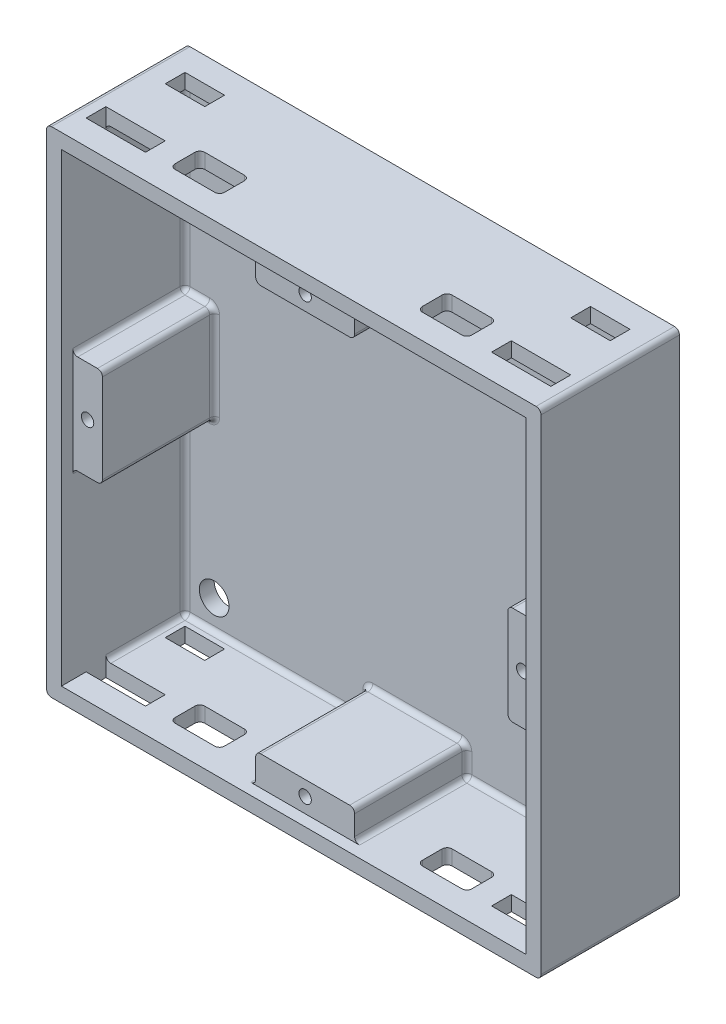
from build123d import *

# Parameters (mm, degrees)
SKETCH1_W                 = 100
SKETCH1_H                 = 100
BOSS_EXTRUDE1_DEPTH       = 3
SKETCH2_W                 = 100
SKETCH2_H                 = 100
SKETCH2_W_2               = 94
SKETCH2_H_2               = 94
BOSS_EXTRUDE2_DEPTH       = 25
SKETCH5_R                 = 3
CUT_EXTRUDE1_DEPTH        = 146.107718609
SKETCH6_W                 = 12
SKETCH6_H                 = 4
SKETCH6_W_2               = 8
CUT_EXTRUDE3_DEPTH        = 145.166570328
SKETCH7_W                 = 6
SKETCH7_H                 = 20
SKETCH7_W_2               = 20
SKETCH7_H_2               = 6
BOSS_EXTRUDE4_DEPTH       = 22.7
M3X0_5_TAPPED_HOLE1_D     = 2.5
M3X0_5_TAPPED_HOLE1_DEPTH = 27
M3X0_5_TAPPED_HOLE1_TIP   = 0.751075774
FILLET1_R                 = 1
FILLET2_R                 = 1
FILLET3_R                 = 1
FILLET4_R                 = 1
FILLET5_R                 = 1
FILLET6_R                 = 1
FILLET7_R                 = 1
FILLET8_R                 = 1
FILLET9_R                 = 1
FILLET10_R                = 1
FILLET11_R                = 1
FILLET12_R                = 1
FILLET22_R                = 1
FILLET23_R                = 1
FILLET24_R                = 1
FILLET25_R                = 1
FILLET26_R                = 1
FILLET27_R                = 1
FILLET28_R                = 1
FILLET29_R                = 1
FILLET30_R                = 1
FILLET31_R                = 1
FILLET32_R                = 1
FILLET33_R                = 1
CUT_EXTRUDE5_DEPTH        = 145.166570328


with BuildPart() as part:
    # Sketch1 → Boss-Extrude1 (new body)
    with BuildSketch(Plane.XY):
        with Locations((50, 50)):
            Rectangle(SKETCH1_W, SKETCH1_H)
    extrude(amount=BOSS_EXTRUDE1_DEPTH)

    # Sketch2 → Boss-Extrude2 (add)
    with BuildSketch(Plane.XY.offset(3)):
        with Locations((50, 50)):
            Rectangle(SKETCH2_W, SKETCH2_H)
        with Locations((50, 50)):
            Rectangle(SKETCH2_W_2, SKETCH2_H_2, mode=Mode.SUBTRACT)
    extrude(amount=BOSS_EXTRUDE2_DEPTH)

    # Sketch5 → Cut-Extrude1 (cut, through all)
    with BuildSketch(Plane.XY.offset(32.5)):
        with Locations((8.9, 8.9)):
            Circle(SKETCH5_R)
        with Locations((8.9, 91.1)):
            Circle(SKETCH5_R)
        with Locations((91.1, 91.1)):
            Circle(SKETCH5_R)
        with Locations((91.1, 8.9)):
            Circle(SKETCH5_R)
    extrude(amount=-CUT_EXTRUDE1_DEPTH, mode=Mode.SUBTRACT)

    # Sketch6 → Cut-Extrude3 (cut, through all)
    with BuildSketch(Plane.XZ):
        with Locations((9, 21)):
            Rectangle(SKETCH6_W, SKETCH6_H)
        with Locations((91, 21)):
            Rectangle(SKETCH6_W, SKETCH6_H)
        with Locations((9, 7)):
            Rectangle(SKETCH6_W_2, SKETCH6_H)
        with Locations((91, 7)):
            Rectangle(SKETCH6_W_2, SKETCH6_H)
    extrude(amount=-CUT_EXTRUDE3_DEPTH, mode=Mode.SUBTRACT)

    # Sketch7 → Boss-Extrude4 (add)
    with BuildSketch(Plane.XY.offset(3)):
        with Locations((6, 50)):
            Rectangle(SKETCH7_W, SKETCH7_H)
        with Locations((50, 94)):
            Rectangle(SKETCH7_W_2, SKETCH7_H_2)
        with Locations((94, 50)):
            Rectangle(SKETCH7_W, SKETCH7_H)
        with Locations((50, 6)):
            Rectangle(SKETCH7_W_2, SKETCH7_H_2)
    extrude(amount=BOSS_EXTRUDE4_DEPTH)

    # M3x0.5 Tapped Hole1
    with Locations(Plane.XY.offset(28)):
        with Locations((6, 50), (50, 94), (94, 50), (50, 6)):
            Hole(M3X0_5_TAPPED_HOLE1_D / 2, depth=M3X0_5_TAPPED_HOLE1_DEPTH)
            with Locations((0, 0, -(M3X0_5_TAPPED_HOLE1_DEPTH + M3X0_5_TAPPED_HOLE1_TIP / 2))):  # 118° drill point
                Cone(0, M3X0_5_TAPPED_HOLE1_D / 2, M3X0_5_TAPPED_HOLE1_TIP, mode=Mode.SUBTRACT)

    # Fillet1
    fillet1_edges = [part.edges().sort_by_distance(p)[0] for p in [
        (0, 0, 14),
    ]]
    fillet(fillet1_edges, radius=FILLET1_R)

    # Fillet2
    fillet2_edges = [part.edges().sort_by_distance(p)[0] for p in [
        (100, 0, 14),
    ]]
    fillet(fillet2_edges, radius=FILLET2_R)

    # Fillet3
    fillet3_edges = [part.edges().sort_by_distance(p)[0] for p in [
        (0, 100, 14),
    ]]
    fillet(fillet3_edges, radius=FILLET3_R)

    # Fillet4
    fillet4_edges = [part.edges().sort_by_distance(p)[0] for p in [
        (100, 100, 14),
    ]]
    fillet(fillet4_edges, radius=FILLET4_R)

    # Fillet5
    fillet5_edges = [part.edges().sort_by_distance(p)[0] for p in [
        (40, 3, 14.35),
    ]]
    fillet(fillet5_edges, radius=FILLET5_R)

    # Fillet6
    fillet6_edges = [part.edges().sort_by_distance(p)[0] for p in [
        (60, 3, 14.35),
    ]]
    fillet(fillet6_edges, radius=FILLET6_R)

    # Fillet7
    fillet7_edges = [part.edges().sort_by_distance(p)[0] for p in [
        (97, 40, 14.35),
    ]]
    fillet(fillet7_edges, radius=FILLET7_R)

    # Fillet8
    fillet8_edges = [part.edges().sort_by_distance(p)[0] for p in [
        (97, 60, 14.35),
    ]]
    fillet(fillet8_edges, radius=FILLET8_R)

    # Fillet9
    fillet9_edges = [part.edges().sort_by_distance(p)[0] for p in [
        (3, 60, 14.35),
    ]]
    fillet(fillet9_edges, radius=FILLET9_R)

    # Fillet10
    fillet10_edges = [part.edges().sort_by_distance(p)[0] for p in [
        (3, 40, 14.35),
    ]]
    fillet(fillet10_edges, radius=FILLET10_R)

    # Fillet11
    fillet11_edges = [part.edges().sort_by_distance(p)[0] for p in [
        (40, 97, 14.35),
    ]]
    fillet(fillet11_edges, radius=FILLET11_R)

    # Fillet12
    fillet12_edges = [part.edges().sort_by_distance(p)[0] for p in [
        (60, 97, 14.35),
    ]]
    fillet(fillet12_edges, radius=FILLET12_R)

    # Fillet22
    fillet22_edges = [part.edges().sort_by_distance(p)[0] for p in [
        (60, 9, 14.35),
    ]]
    fillet(fillet22_edges, radius=FILLET22_R)

    # Fillet23
    fillet23_edges = [part.edges().sort_by_distance(p)[0] for p in [
        (40, 9, 14.35),
    ]]
    fillet(fillet23_edges, radius=FILLET23_R)

    # Fillet24
    fillet24_edges = [part.edges().sort_by_distance(p)[0] for p in [
        (91, 60, 14.35),
    ]]
    fillet(fillet24_edges, radius=FILLET24_R)

    # Fillet25
    fillet25_edges = [part.edges().sort_by_distance(p)[0] for p in [
        (91, 40, 14.35),
    ]]
    fillet(fillet25_edges, radius=FILLET25_R)

    # Fillet26
    fillet26_edges = [part.edges().sort_by_distance(p)[0] for p in [
        (9, 60, 14.35),
    ]]
    fillet(fillet26_edges, radius=FILLET26_R)

    # Fillet27
    fillet27_edges = [part.edges().sort_by_distance(p)[0] for p in [
        (9, 40, 14.35),
    ]]
    fillet(fillet27_edges, radius=FILLET27_R)

    # Fillet28
    fillet28_edges = [part.edges().sort_by_distance(p)[0] for p in [
        (60, 91, 14.35),
    ]]
    fillet(fillet28_edges, radius=FILLET28_R)

    # Fillet29
    fillet29_edges = [part.edges().sort_by_distance(p)[0] for p in [
        (40, 91, 14.35),
    ]]
    fillet(fillet29_edges, radius=FILLET29_R)

    # Fillet30
    fillet30_edges = [part.edges().sort_by_distance(p)[0] for p in [
        (21, 3, 3),
        (39.707106781, 3.292893219, 3),
        (60, 6, 3),
        (79, 3, 3),
        (60.292893219, 3.292893219, 3),
        (50, 9, 3),
        (59.707106781, 8.707106781, 3),
        (40, 6, 3),
        (40.292893219, 8.707106781, 3),
    ]]
    fillet(fillet30_edges, radius=FILLET30_R)

    # Fillet31
    fillet31_edges = [part.edges().sort_by_distance(p)[0] for p in [
        (3, 79, 3),
        (3.292893219, 60.292893219, 3),
        (3, 21.5, 3),
        (6, 40, 3),
        (3.292893219, 39.707106781, 3),
        (6, 60, 3),
        (8.707106781, 59.707106781, 3),
        (9, 50, 3),
        (8.707106781, 40.292893219, 3),
        (3, 3.292893219, 3.292893219),
        (3, 3, 11.5),
    ]]
    fillet(fillet31_edges, radius=FILLET31_R)

    # Fillet32
    fillet32_edges = [part.edges().sort_by_distance(p)[0] for p in [
        (79, 97, 3),
        (21.5, 97, 3),
        (40, 94, 3),
        (39.707106781, 96.707106781, 3),
        (60.292893219, 96.707106781, 3),
        (60, 94, 3),
        (59.707106781, 91.292893219, 3),
        (50, 91, 3),
        (40.292893219, 91.292893219, 3),
        (3.292893219, 97, 3.292893219),
        (3, 97, 11.5),
    ]]
    fillet(fillet32_edges, radius=FILLET32_R)

    # Fillet33
    fillet33_edges = [part.edges().sort_by_distance(p)[0] for p in [
        (96.707106781, 39.707106781, 3),
        (97, 78.5, 3),
        (94, 60, 3),
        (96.707106781, 60.292893219, 3),
        (91, 50, 3),
        (91.292893219, 59.707106781, 3),
        (94, 40, 3),
        (91.292893219, 40.292893219, 3),
        (97, 21.5, 3),
        (97, 3.292893219, 3.292893219),
        (97, 96.707106781, 3.292893219),
        (97, 97, 11.5),
        (97, 3, 11.5),
    ]]
    fillet(fillet33_edges, radius=FILLET33_R)

    # Sketch12 → Cut-Extrude5 (cut, through all)
    with BuildSketch(Plane.XZ):
        with BuildLine():
            Line((21, 17), (29, 17))
            ThreePointArc((29, 17), (29.707106781, 17.292893219), (30, 18))
            Line((30, 18), (30, 22))
            ThreePointArc((30, 22), (29.707106781, 22.707106781), (29, 23))
            Line((29, 23), (21, 23))
            ThreePointArc((21, 23), (20.292893219, 22.707106781), (20, 22))
            Line((20, 22), (20, 18))
            ThreePointArc((20, 18), (20.292893219, 17.292893219), (21, 17))
        make_face()
        with BuildLine():
            Line((71, 17), (79, 17))
            ThreePointArc((79, 17), (79.707106781, 17.292893219), (80, 18))
            Line((80, 18), (80, 22))
            ThreePointArc((80, 22), (79.707106781, 22.707106781), (79, 23))
            Line((79, 23), (71, 23))
            ThreePointArc((71, 23), (70.292893219, 22.707106781), (70, 22))
            Line((70, 22), (70, 18))
            ThreePointArc((70, 18), (70.292893219, 17.292893219), (71, 17))
        make_face()
    extrude(amount=-CUT_EXTRUDE5_DEPTH, mode=Mode.SUBTRACT)


solid = part.part
